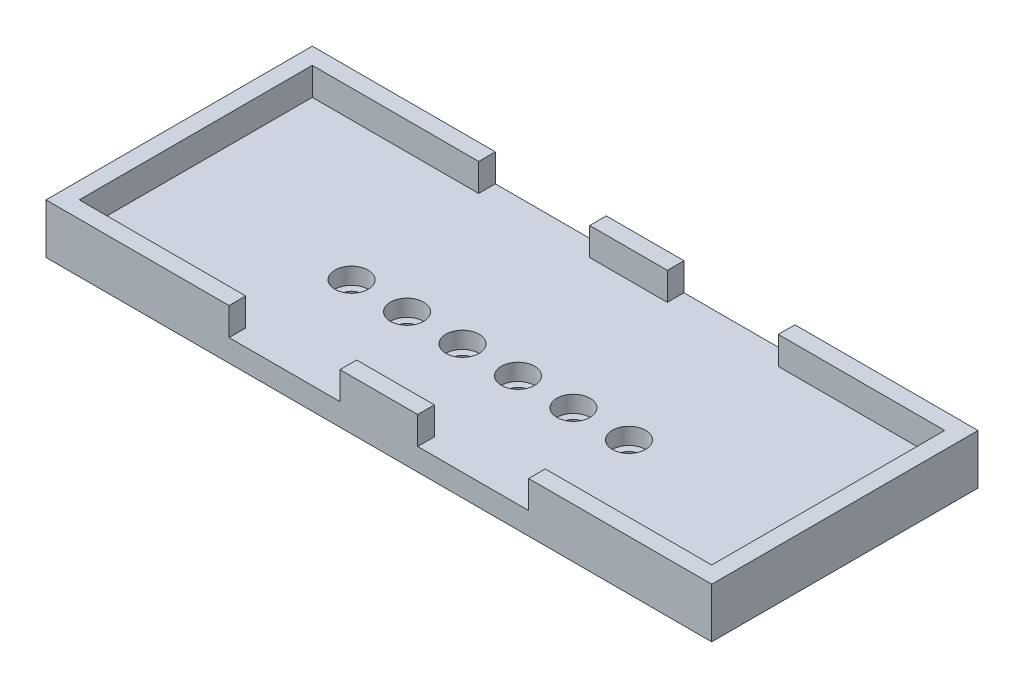
from build123d import *

# Parameters (mm, degrees)
SKETCH1_W           = 120
SKETCH1_H           = 48
BOSS_EXTRUDE1_DEPTH = 4
SKETCH2_W           = 14
SKETCH2_H           = 3
BOSS_EXTRUDE2_DEPTH = 5
SKETCH3_R           = 1.7
CUT_EXTRUDE1_DEPTH  = 5
SKETCH4_R           = 3
CUT_EXTRUDE2_DEPTH  = 3


with BuildPart() as part:
    # Sketch1 → Boss-Extrude1 (new body)
    with BuildSketch(Plane(origin=(0, 0, 0), x_dir=(1, 0, 0), z_dir=(0, 1, 0))):
        with Locations((9.738916256, -3.92364532)):
            Rectangle(SKETCH1_W, SKETCH1_H)
    extrude(amount=BOSS_EXTRUDE1_DEPTH)

    # Sketch2 → Boss-Extrude2 (add)
    with BuildSketch(Plane(origin=(0, 4, 0), x_dir=(1, 0, 0), z_dir=(0, 1, 0))):
        Polygon((-50.261083744, 20.07635468), (-17.261083744, 20.07635468), (-17.261083744, 17.07635468), (-47.261083744, 17.07635468), (-47.261083744, -24.92364532), (-17.261083744, -24.92364532), (-17.261083744, -27.92364532), (-50.261083744, -27.92364532), align=None)
        Polygon((69.738916256, 20.07635468), (69.738916256, -27.92364532), (36.738916256, -27.92364532), (36.738916256, -24.92364532), (66.738916256, -24.92364532), (66.738916256, 17.07635468), (36.738916256, 17.07635468), (36.738916256, 20.07635468), align=None)
        with Locations((9.738916256, 18.57635468)):
            Rectangle(SKETCH2_W, SKETCH2_H)
        with Locations((9.738916256, -26.42364532)):
            Rectangle(SKETCH2_W, SKETCH2_H)
    extrude(amount=BOSS_EXTRUDE2_DEPTH)

    # Sketch3 → Cut-Extrude1 (cut)
    with BuildSketch(Plane(origin=(0, 4, 0), x_dir=(1, 0, 0), z_dir=(0, 1, 0))):
        with Locations(Location((4.738916256, -7.848492391, 0), (0, 0, 270))):
            Circle(SKETCH3_R)
        with Locations(Location((-5.261083744, -7.848492391, 0), (0, 0, 270))):
            Circle(SKETCH3_R)
        with Locations(Location((-15.261083744, -7.848492391, 0), (0, 0, 270))):
            Circle(SKETCH3_R)
        with Locations(Location((34.738916256, -7.848492391, 0), (0, 0, 90))):
            Circle(SKETCH3_R)
        with Locations(Location((24.738916256, -7.848492391, 0), (0, 0, 90))):
            Circle(SKETCH3_R)
        with Locations(Location((14.738916256, -7.848492391, 0), (0, 0, 90))):
            Circle(SKETCH3_R)
    extrude(amount=-CUT_EXTRUDE1_DEPTH, mode=Mode.SUBTRACT)

    # Sketch4 → Cut-Extrude2 (cut)
    with BuildSketch(Plane(origin=(0, 4, 0), x_dir=(1, 0, 0), z_dir=(0, 1, 0))):
        with Locations(Location((-15.261083744, -7.848492391, 0), (0, 0, 270))):
            Circle(SKETCH4_R)
        with Locations(Location((-5.261083744, -7.848492391, 0), (0, 0, 270))):
            Circle(SKETCH4_R)
        with Locations(Location((4.738916256, -7.848492391, 0), (0, 0, 270))):
            Circle(SKETCH4_R)
        with Locations(Location((14.738916256, -7.848492391, 0), (0, 0, 270))):
            Circle(SKETCH4_R)
        with Locations(Location((24.738916256, -7.848492391, 0), (0, 0, 270))):
            Circle(SKETCH4_R)
        with Locations(Location((34.738916256, -7.848492391, 0), (0, 0, 270))):
            Circle(SKETCH4_R)
    extrude(amount=-CUT_EXTRUDE2_DEPTH, mode=Mode.SUBTRACT)


solid = part.part
